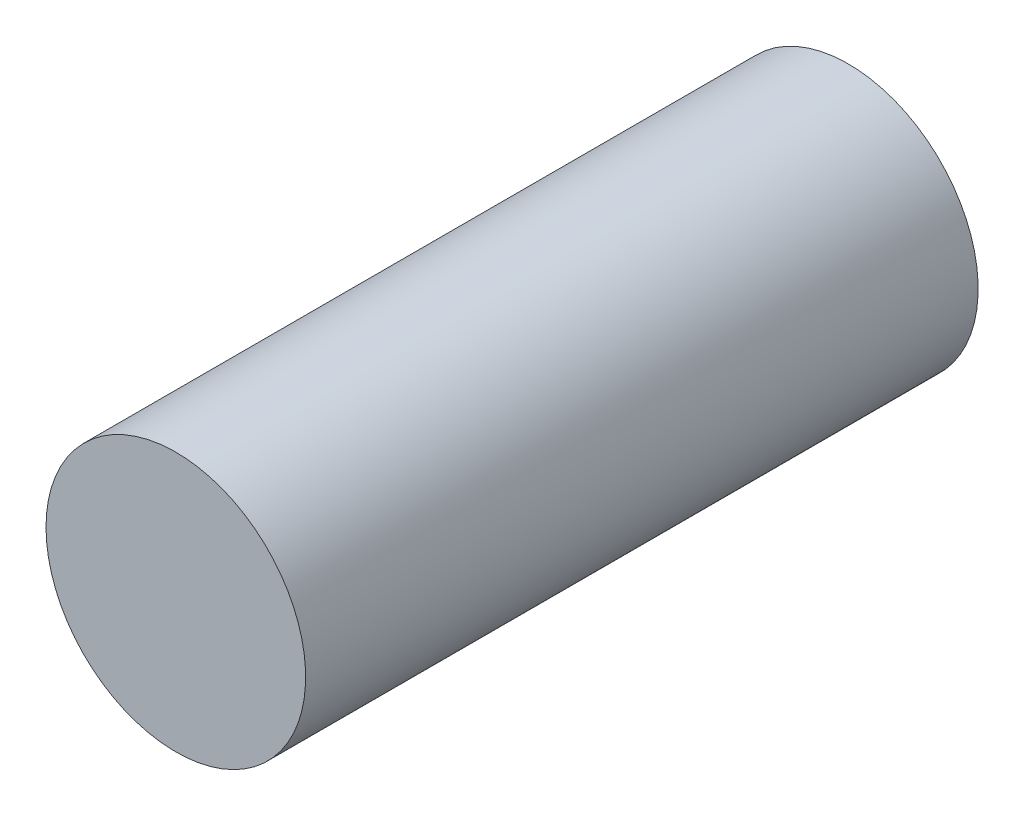
from build123d import *

# Parameters (mm, degrees)
SKETCH1_R           = 10
BOSS_EXTRUDE1_DEPTH = 51.8


with BuildPart() as part:
    # Sketch1 → Boss-Extrude1 (new body)
    with BuildSketch(Plane.XY):
        with Locations(Location((0, 0, 0), (0, 0, 180))):
            Circle(SKETCH1_R)
    extrude(amount=BOSS_EXTRUDE1_DEPTH)


solid = part.part
